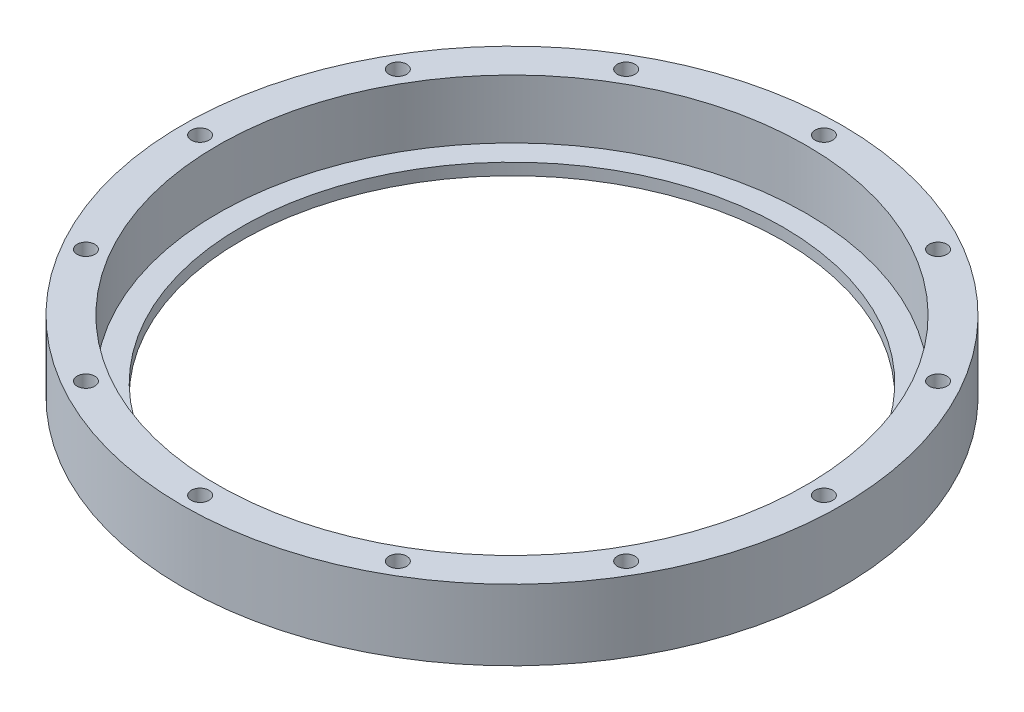
from build123d import *

# Parameters (mm, degrees)
SKETCH_3_R          = 1.5
CUT_EXTRUDE_3_DEPTH = 81.099937578


with BuildPart() as part:
    # 草图2 → 旋转1 (revolve)
    with BuildSketch(Plane.XY, mode=Mode.PRIVATE) as revolve_1_sk:
        Polygon((46, 0), (46, 2), (50, 2), (50, 12), (56, 12), (56, 0), align=None)
    revolve(revolve_1_sk.sketch.rotate(Axis((0, 0, 0), (0, 1, 0)), 90), axis=Axis((0, 0, 0), (0, 1, 0)))

    # 草图3 → 切除-拉伸3 (cut, through all)
    with BuildSketch(Plane(origin=(0, 0, 0), x_dir=(1, 0, 0), z_dir=(0, 1, 0))):
        with Locations(Location((0, 53, 0), (0, 0, 270))):
            Circle(SKETCH_3_R)
        with Locations(Location((26.5, 45.899346401, 0), (0, 0, 270))):
            Circle(SKETCH_3_R)
        with Locations(Location((45.899346401, 26.5, 0), (0, 0, 270))):
            Circle(SKETCH_3_R)
        with Locations(Location((53, 0, 0), (0, 0, 270))):
            Circle(SKETCH_3_R)
        with Locations(Location((45.899346401, -26.5, 0), (0, 0, 270))):
            Circle(SKETCH_3_R)
        with Locations(Location((26.5, -45.899346401, 0), (0, 0, 270))):
            Circle(SKETCH_3_R)
        with Locations(Location((0, -53, 0), (0, 0, 270))):
            Circle(SKETCH_3_R)
        with Locations(Location((-26.5, -45.899346401, 0), (0, 0, 270))):
            Circle(SKETCH_3_R)
        with Locations(Location((-45.899346401, -26.5, 0), (0, 0, 270))):
            Circle(SKETCH_3_R)
        with Locations(Location((-53, 0, 0), (0, 0, 270))):
            Circle(SKETCH_3_R)
        with Locations(Location((-45.899346401, 26.5, 0), (0, 0, 270))):
            Circle(SKETCH_3_R)
        with Locations(Location((-26.5, 45.899346401, 0), (0, 0, 270))):
            Circle(SKETCH_3_R)
    extrude(amount=CUT_EXTRUDE_3_DEPTH, mode=Mode.SUBTRACT)


solid = part.part
